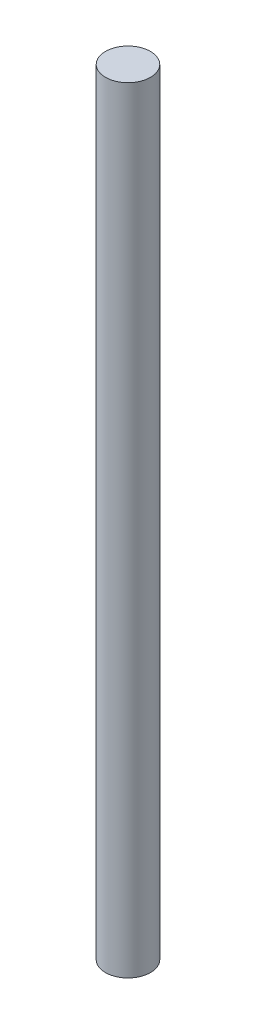
from build123d import *

# Parameters (mm, degrees)
CROQUIS1_R              = 1.45
SALIENTE_EXTRUIR1_DEPTH = 50


with BuildPart() as part:
    # Croquis1 → Saliente-Extruir1 (new body)
    with BuildSketch(Plane(origin=(0, 0, 0), x_dir=(1, 0, 0), z_dir=(0, 1, 0))):
        with Locations(Location((0, 0, 0), (0, 0, 270))):
            Circle(CROQUIS1_R)
    extrude(amount=SALIENTE_EXTRUIR1_DEPTH)


solid = part.part
